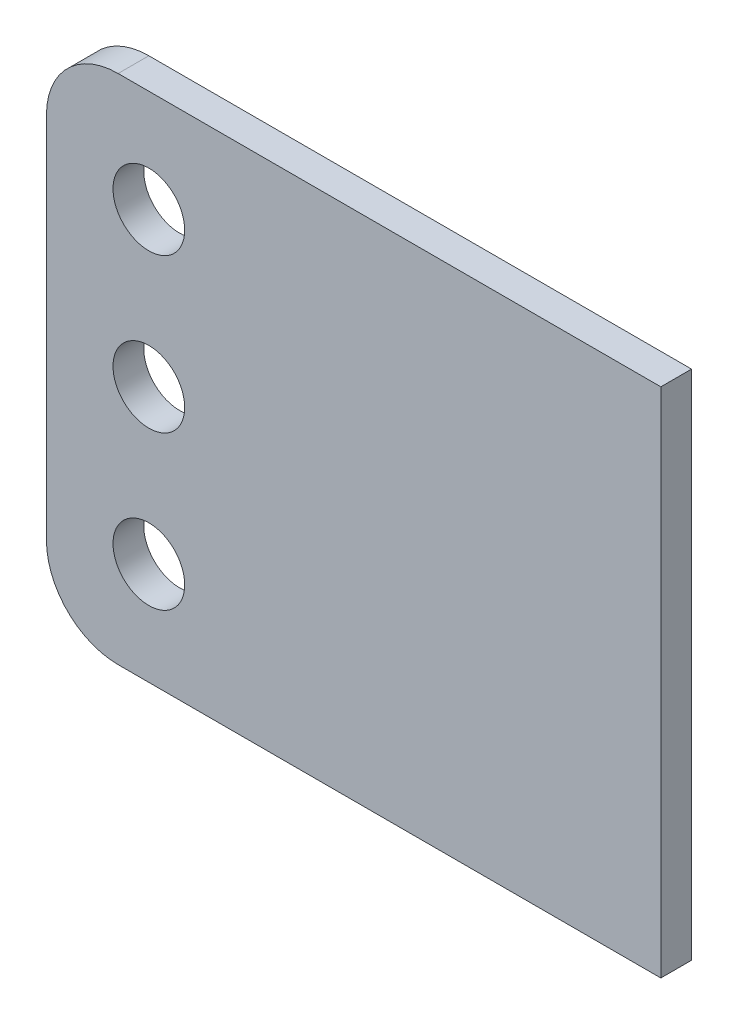
from build123d import *

# Parameters (mm, degrees)
ESQUISSE1_W             = 60
ESQUISSE1_H             = 50
BOSS_EXTRU_1_DEPTH      = 3
ESQUISSE2_R             = 3.5
ENL_V_MAT_EXTRU_1_DEPTH = 3
CONG_1_R                = 7


with BuildPart() as part:
    # Esquisse1 → Boss.-Extru.1 (new body)
    with BuildSketch(Plane.XY):
        with Locations((30, 25)):
            Rectangle(ESQUISSE1_W, ESQUISSE1_H)
    extrude(amount=BOSS_EXTRU_1_DEPTH)

    # Esquisse2 → Enlèv. mat.-Extru.1 (cut)
    with BuildSketch(Plane.XY.offset(3)):
        with Locations((10, 10)):
            Circle(ESQUISSE2_R)
        with Locations((10, 25)):
            Circle(ESQUISSE2_R)
        with Locations((10, 40)):
            Circle(ESQUISSE2_R)
    extrude(amount=-ENL_V_MAT_EXTRU_1_DEPTH, mode=Mode.SUBTRACT)

    # Congé1
    cong_1_edges = [part.edges().sort_by_distance(p)[0] for p in [
        (0, 50, 1.5),
        (0, 0, 1.5),
    ]]
    fillet(cong_1_edges, radius=CONG_1_R)


solid = part.part
